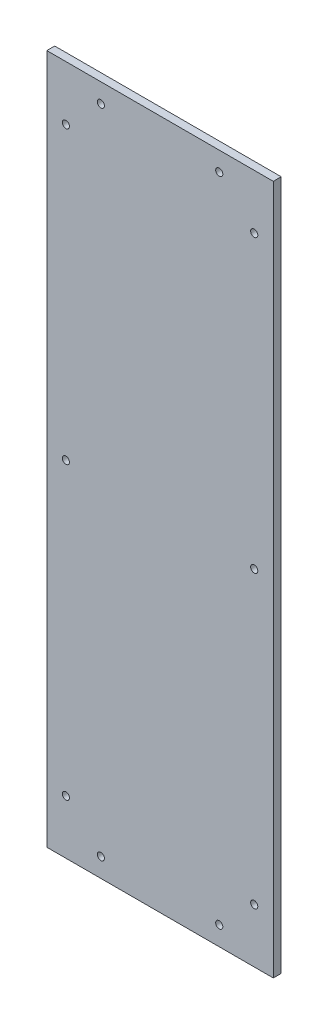
from build123d import *

# Parameters (mm, degrees)
SKETCH1_W             = 136.525
SKETCH1_H             = 415.925
BOSS_EXTRUDE1_DEPTH   = 4.7625
F_8_CLEARANCE_HOLE1_D = 4.3053


with BuildPart() as part:
    # Sketch1 → Boss-Extrude1 (new body)
    with BuildSketch(Plane.XY):
        with Locations((-56.553919361, 0.550165344)):
            Rectangle(SKETCH1_W, SKETCH1_H)
    extrude(amount=BOSS_EXTRUDE1_DEPTH)

    # #8 Clearance Hole1 (through all)
    with Locations(Plane(origin=(0, 0, 0), x_dir=(-1, 0, 0), z_dir=(0, 0, -1))):
        with Locations((92.240919361, -195.918834656), (113.322919361, -174.836834656), (20.866919361, -195.918834656), (-0.215080639, -174.836834656), (113.322919361, 0.423165344), (92.240919361, 197.019165344), (20.866919361, 197.019165344), (-0.215080639, 0.423165344), (113.322919361, 175.683165344), (-0.215080639, 175.683165344)):
            Hole(F_8_CLEARANCE_HOLE1_D / 2)


solid = part.part
